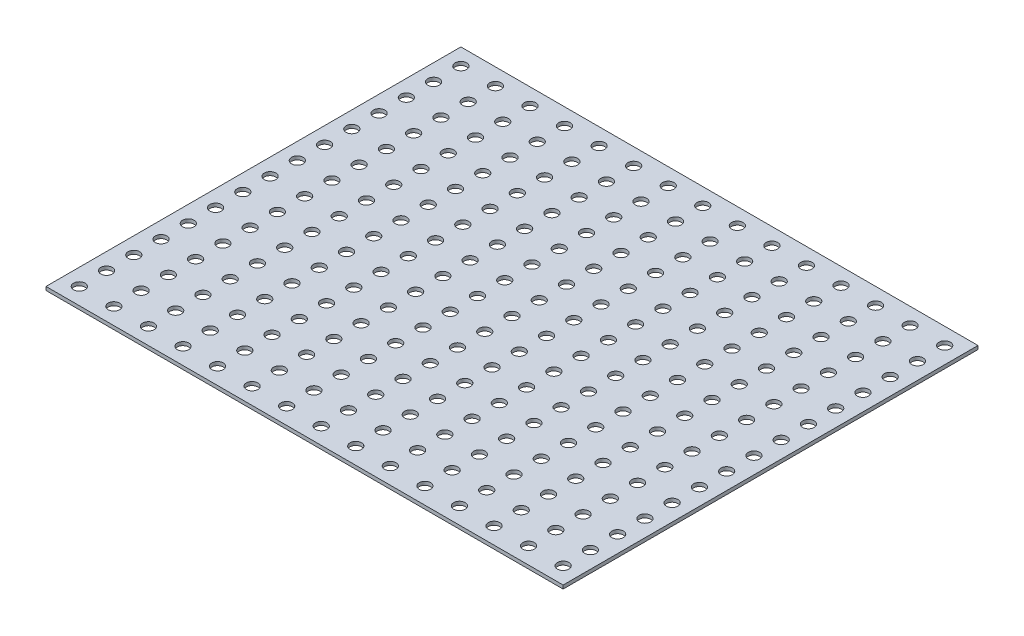
from build123d import *

# Parameters (mm, degrees)
SKETCH1_W           = 189.74
SKETCH1_H           = 152.22
SKETCH1_R           = 2.11
BOSS_EXTRUDE1_DEPTH = 1.3


with BuildPart() as part:
    # Sketch1 → Boss-Extrude1 (new body)
    with BuildSketch(Plane(origin=(0, 0, 0), x_dir=(1, 0, 0), z_dir=(0, 1, 0))):
        with Locations((70.568763426, -57.971179366)):
            Rectangle(SKETCH1_W, SKETCH1_H)
        with Locations(Location((-18.191236574, 12.028820634, 0), (0, 0, 270))):
            Circle(SKETCH1_R, mode=Mode.SUBTRACT)
        with Locations(Location((-5.511236574, 12.028820634, 0), (0, 0, 270))):
            Circle(SKETCH1_R, mode=Mode.SUBTRACT)
        with Locations(Location((7.168763426, 12.028820634, 0), (0, 0, 270))):
            Circle(SKETCH1_R, mode=Mode.SUBTRACT)
        with Locations(Location((19.848763426, 12.028820634, 0), (0, 0, 270))):
            Circle(SKETCH1_R, mode=Mode.SUBTRACT)
        with Locations(Location((32.528763426, 12.028820634, 0), (0, 0, 270))):
            Circle(SKETCH1_R, mode=Mode.SUBTRACT)
        with Locations(Location((45.208763426, 12.028820634, 0), (0, 0, 270))):
            Circle(SKETCH1_R, mode=Mode.SUBTRACT)
        with Locations(Location((57.888763426, 12.028820634, 0), (0, 0, 270))):
            Circle(SKETCH1_R, mode=Mode.SUBTRACT)
        with Locations(Location((70.568763426, 12.028820634, 0), (0, 0, 270))):
            Circle(SKETCH1_R, mode=Mode.SUBTRACT)
        with Locations(Location((83.248763426, 12.028820634, 0), (0, 0, 270))):
            Circle(SKETCH1_R, mode=Mode.SUBTRACT)
        with Locations(Location((95.928763426, 12.028820634, 0), (0, 0, 270))):
            Circle(SKETCH1_R, mode=Mode.SUBTRACT)
        with Locations(Location((108.608763426, 12.028820634, 0), (0, 0, 270))):
            Circle(SKETCH1_R, mode=Mode.SUBTRACT)
        with Locations(Location((121.288763426, 12.028820634, 0), (0, 0, 270))):
            Circle(SKETCH1_R, mode=Mode.SUBTRACT)
        with Locations(Location((133.968763426, 12.028820634, 0), (0, 0, 270))):
            Circle(SKETCH1_R, mode=Mode.SUBTRACT)
        with Locations(Location((146.648763426, 12.028820634, 0), (0, 0, 270))):
            Circle(SKETCH1_R, mode=Mode.SUBTRACT)
        with Locations(Location((159.328763426, 12.028820634, 0), (0, 0, 270))):
            Circle(SKETCH1_R, mode=Mode.SUBTRACT)
        with Locations(Location((-5.511236574, 2.028820634, 0), (0, 0, 270))):
            Circle(SKETCH1_R, mode=Mode.SUBTRACT)
        with Locations(Location((7.168763426, 2.028820634, 0), (0, 0, 270))):
            Circle(SKETCH1_R, mode=Mode.SUBTRACT)
        with Locations(Location((19.848763426, 2.028820634, 0), (0, 0, 270))):
            Circle(SKETCH1_R, mode=Mode.SUBTRACT)
        with Locations(Location((32.528763426, 2.028820634, 0), (0, 0, 270))):
            Circle(SKETCH1_R, mode=Mode.SUBTRACT)
        with Locations(Location((45.208763426, 2.028820634, 0), (0, 0, 270))):
            Circle(SKETCH1_R, mode=Mode.SUBTRACT)
        with Locations(Location((57.888763426, 2.028820634, 0), (0, 0, 270))):
            Circle(SKETCH1_R, mode=Mode.SUBTRACT)
        with Locations(Location((70.568763426, 2.028820634, 0), (0, 0, 270))):
            Circle(SKETCH1_R, mode=Mode.SUBTRACT)
        with Locations(Location((83.248763426, 2.028820634, 0), (0, 0, 270))):
            Circle(SKETCH1_R, mode=Mode.SUBTRACT)
        with Locations(Location((95.928763426, 2.028820634, 0), (0, 0, 270))):
            Circle(SKETCH1_R, mode=Mode.SUBTRACT)
        with Locations(Location((108.608763426, 2.028820634, 0), (0, 0, 270))):
            Circle(SKETCH1_R, mode=Mode.SUBTRACT)
        with Locations(Location((121.288763426, 2.028820634, 0), (0, 0, 270))):
            Circle(SKETCH1_R, mode=Mode.SUBTRACT)
        with Locations(Location((133.968763426, 2.028820634, 0), (0, 0, 270))):
            Circle(SKETCH1_R, mode=Mode.SUBTRACT)
        with Locations(Location((146.648763426, 2.028820634, 0), (0, 0, 270))):
            Circle(SKETCH1_R, mode=Mode.SUBTRACT)
        with Locations(Location((159.328763426, 2.028820634, 0), (0, 0, 270))):
            Circle(SKETCH1_R, mode=Mode.SUBTRACT)
        with Locations(Location((-5.511236574, -7.971179366, 0), (0, 0, 270))):
            Circle(SKETCH1_R, mode=Mode.SUBTRACT)
        with Locations(Location((7.168763426, -7.971179366, 0), (0, 0, 270))):
            Circle(SKETCH1_R, mode=Mode.SUBTRACT)
        with Locations(Location((19.848763426, -7.971179366, 0), (0, 0, 270))):
            Circle(SKETCH1_R, mode=Mode.SUBTRACT)
        with Locations(Location((32.528763426, -7.971179366, 0), (0, 0, 270))):
            Circle(SKETCH1_R, mode=Mode.SUBTRACT)
        with Locations(Location((45.208763426, -7.971179366, 0), (0, 0, 270))):
            Circle(SKETCH1_R, mode=Mode.SUBTRACT)
        with Locations(Location((57.888763426, -7.971179366, 0), (0, 0, 270))):
            Circle(SKETCH1_R, mode=Mode.SUBTRACT)
        with Locations(Location((70.568763426, -7.971179366, 0), (0, 0, 270))):
            Circle(SKETCH1_R, mode=Mode.SUBTRACT)
        with Locations(Location((83.248763426, -7.971179366, 0), (0, 0, 270))):
            Circle(SKETCH1_R, mode=Mode.SUBTRACT)
        with Locations(Location((95.928763426, -7.971179366, 0), (0, 0, 270))):
            Circle(SKETCH1_R, mode=Mode.SUBTRACT)
        with Locations(Location((108.608763426, -7.971179366, 0), (0, 0, 270))):
            Circle(SKETCH1_R, mode=Mode.SUBTRACT)
        with Locations(Location((121.288763426, -7.971179366, 0), (0, 0, 270))):
            Circle(SKETCH1_R, mode=Mode.SUBTRACT)
        with Locations(Location((133.968763426, -7.971179366, 0), (0, 0, 270))):
            Circle(SKETCH1_R, mode=Mode.SUBTRACT)
        with Locations(Location((146.648763426, -7.971179366, 0), (0, 0, 270))):
            Circle(SKETCH1_R, mode=Mode.SUBTRACT)
        with Locations(Location((159.328763426, -7.971179366, 0), (0, 0, 270))):
            Circle(SKETCH1_R, mode=Mode.SUBTRACT)
        with Locations(Location((-5.511236574, -17.971179366, 0), (0, 0, 270))):
            Circle(SKETCH1_R, mode=Mode.SUBTRACT)
        with Locations(Location((7.168763426, -17.971179366, 0), (0, 0, 270))):
            Circle(SKETCH1_R, mode=Mode.SUBTRACT)
        with Locations(Location((19.848763426, -17.971179366, 0), (0, 0, 270))):
            Circle(SKETCH1_R, mode=Mode.SUBTRACT)
        with Locations(Location((32.528763426, -17.971179366, 0), (0, 0, 270))):
            Circle(SKETCH1_R, mode=Mode.SUBTRACT)
        with Locations(Location((45.208763426, -17.971179366, 0), (0, 0, 270))):
            Circle(SKETCH1_R, mode=Mode.SUBTRACT)
        with Locations(Location((57.888763426, -17.971179366, 0), (0, 0, 270))):
            Circle(SKETCH1_R, mode=Mode.SUBTRACT)
        with Locations(Location((70.568763426, -17.971179366, 0), (0, 0, 270))):
            Circle(SKETCH1_R, mode=Mode.SUBTRACT)
        with Locations(Location((83.248763426, -17.971179366, 0), (0, 0, 270))):
            Circle(SKETCH1_R, mode=Mode.SUBTRACT)
        with Locations(Location((95.928763426, -17.971179366, 0), (0, 0, 270))):
            Circle(SKETCH1_R, mode=Mode.SUBTRACT)
        with Locations(Location((108.608763426, -17.971179366, 0), (0, 0, 270))):
            Circle(SKETCH1_R, mode=Mode.SUBTRACT)
        with Locations(Location((121.288763426, -17.971179366, 0), (0, 0, 270))):
            Circle(SKETCH1_R, mode=Mode.SUBTRACT)
        with Locations(Location((133.968763426, -17.971179366, 0), (0, 0, 270))):
            Circle(SKETCH1_R, mode=Mode.SUBTRACT)
        with Locations(Location((146.648763426, -17.971179366, 0), (0, 0, 270))):
            Circle(SKETCH1_R, mode=Mode.SUBTRACT)
        with Locations(Location((159.328763426, -17.971179366, 0), (0, 0, 270))):
            Circle(SKETCH1_R, mode=Mode.SUBTRACT)
        with Locations(Location((-5.511236574, -27.971179366, 0), (0, 0, 270))):
            Circle(SKETCH1_R, mode=Mode.SUBTRACT)
        with Locations(Location((7.168763426, -27.971179366, 0), (0, 0, 270))):
            Circle(SKETCH1_R, mode=Mode.SUBTRACT)
        with Locations(Location((19.848763426, -27.971179366, 0), (0, 0, 270))):
            Circle(SKETCH1_R, mode=Mode.SUBTRACT)
        with Locations(Location((32.528763426, -27.971179366, 0), (0, 0, 270))):
            Circle(SKETCH1_R, mode=Mode.SUBTRACT)
        with Locations(Location((45.208763426, -27.971179366, 0), (0, 0, 270))):
            Circle(SKETCH1_R, mode=Mode.SUBTRACT)
        with Locations(Location((57.888763426, -27.971179366, 0), (0, 0, 270))):
            Circle(SKETCH1_R, mode=Mode.SUBTRACT)
        with Locations(Location((70.568763426, -27.971179366, 0), (0, 0, 270))):
            Circle(SKETCH1_R, mode=Mode.SUBTRACT)
        with Locations(Location((83.248763426, -27.971179366, 0), (0, 0, 270))):
            Circle(SKETCH1_R, mode=Mode.SUBTRACT)
        with Locations(Location((95.928763426, -27.971179366, 0), (0, 0, 270))):
            Circle(SKETCH1_R, mode=Mode.SUBTRACT)
        with Locations(Location((108.608763426, -27.971179366, 0), (0, 0, 270))):
            Circle(SKETCH1_R, mode=Mode.SUBTRACT)
        with Locations(Location((121.288763426, -27.971179366, 0), (0, 0, 270))):
            Circle(SKETCH1_R, mode=Mode.SUBTRACT)
        with Locations(Location((133.968763426, -27.971179366, 0), (0, 0, 270))):
            Circle(SKETCH1_R, mode=Mode.SUBTRACT)
        with Locations(Location((146.648763426, -27.971179366, 0), (0, 0, 270))):
            Circle(SKETCH1_R, mode=Mode.SUBTRACT)
        with Locations(Location((159.328763426, -27.971179366, 0), (0, 0, 270))):
            Circle(SKETCH1_R, mode=Mode.SUBTRACT)
        with Locations(Location((-5.511236574, -37.971179366, 0), (0, 0, 270))):
            Circle(SKETCH1_R, mode=Mode.SUBTRACT)
        with Locations(Location((7.168763426, -37.971179366, 0), (0, 0, 270))):
            Circle(SKETCH1_R, mode=Mode.SUBTRACT)
        with Locations(Location((19.848763426, -37.971179366, 0), (0, 0, 270))):
            Circle(SKETCH1_R, mode=Mode.SUBTRACT)
        with Locations(Location((32.528763426, -37.971179366, 0), (0, 0, 270))):
            Circle(SKETCH1_R, mode=Mode.SUBTRACT)
        with Locations(Location((45.208763426, -37.971179366, 0), (0, 0, 270))):
            Circle(SKETCH1_R, mode=Mode.SUBTRACT)
        with Locations(Location((57.888763426, -37.971179366, 0), (0, 0, 270))):
            Circle(SKETCH1_R, mode=Mode.SUBTRACT)
        with Locations(Location((70.568763426, -37.971179366, 0), (0, 0, 270))):
            Circle(SKETCH1_R, mode=Mode.SUBTRACT)
        with Locations(Location((83.248763426, -37.971179366, 0), (0, 0, 270))):
            Circle(SKETCH1_R, mode=Mode.SUBTRACT)
        with Locations(Location((95.928763426, -37.971179366, 0), (0, 0, 270))):
            Circle(SKETCH1_R, mode=Mode.SUBTRACT)
        with Locations(Location((108.608763426, -37.971179366, 0), (0, 0, 270))):
            Circle(SKETCH1_R, mode=Mode.SUBTRACT)
        with Locations(Location((121.288763426, -37.971179366, 0), (0, 0, 270))):
            Circle(SKETCH1_R, mode=Mode.SUBTRACT)
        with Locations(Location((133.968763426, -37.971179366, 0), (0, 0, 270))):
            Circle(SKETCH1_R, mode=Mode.SUBTRACT)
        with Locations(Location((146.648763426, -37.971179366, 0), (0, 0, 270))):
            Circle(SKETCH1_R, mode=Mode.SUBTRACT)
        with Locations(Location((159.328763426, -37.971179366, 0), (0, 0, 270))):
            Circle(SKETCH1_R, mode=Mode.SUBTRACT)
        with Locations(Location((-5.511236574, -47.971179366, 0), (0, 0, 270))):
            Circle(SKETCH1_R, mode=Mode.SUBTRACT)
        with Locations(Location((7.168763426, -47.971179366, 0), (0, 0, 270))):
            Circle(SKETCH1_R, mode=Mode.SUBTRACT)
        with Locations(Location((19.848763426, -47.971179366, 0), (0, 0, 270))):
            Circle(SKETCH1_R, mode=Mode.SUBTRACT)
        with Locations(Location((32.528763426, -47.971179366, 0), (0, 0, 270))):
            Circle(SKETCH1_R, mode=Mode.SUBTRACT)
        with Locations(Location((45.208763426, -47.971179366, 0), (0, 0, 270))):
            Circle(SKETCH1_R, mode=Mode.SUBTRACT)
        with Locations(Location((57.888763426, -47.971179366, 0), (0, 0, 270))):
            Circle(SKETCH1_R, mode=Mode.SUBTRACT)
        with Locations(Location((70.568763426, -47.971179366, 0), (0, 0, 270))):
            Circle(SKETCH1_R, mode=Mode.SUBTRACT)
        with Locations(Location((83.248763426, -47.971179366, 0), (0, 0, 270))):
            Circle(SKETCH1_R, mode=Mode.SUBTRACT)
        with Locations(Location((95.928763426, -47.971179366, 0), (0, 0, 270))):
            Circle(SKETCH1_R, mode=Mode.SUBTRACT)
        with Locations(Location((108.608763426, -47.971179366, 0), (0, 0, 270))):
            Circle(SKETCH1_R, mode=Mode.SUBTRACT)
        with Locations(Location((121.288763426, -47.971179366, 0), (0, 0, 270))):
            Circle(SKETCH1_R, mode=Mode.SUBTRACT)
        with Locations(Location((133.968763426, -47.971179366, 0), (0, 0, 270))):
            Circle(SKETCH1_R, mode=Mode.SUBTRACT)
        with Locations(Location((146.648763426, -47.971179366, 0), (0, 0, 270))):
            Circle(SKETCH1_R, mode=Mode.SUBTRACT)
        with Locations(Location((159.328763426, -47.971179366, 0), (0, 0, 270))):
            Circle(SKETCH1_R, mode=Mode.SUBTRACT)
        with Locations(Location((-5.511236574, -57.971179366, 0), (0, 0, 270))):
            Circle(SKETCH1_R, mode=Mode.SUBTRACT)
        with Locations(Location((7.168763426, -57.971179366, 0), (0, 0, 270))):
            Circle(SKETCH1_R, mode=Mode.SUBTRACT)
        with Locations(Location((19.848763426, -57.971179366, 0), (0, 0, 270))):
            Circle(SKETCH1_R, mode=Mode.SUBTRACT)
        with Locations(Location((32.528763426, -57.971179366, 0), (0, 0, 270))):
            Circle(SKETCH1_R, mode=Mode.SUBTRACT)
        with Locations(Location((45.208763426, -57.971179366, 0), (0, 0, 270))):
            Circle(SKETCH1_R, mode=Mode.SUBTRACT)
        with Locations(Location((57.888763426, -57.971179366, 0), (0, 0, 270))):
            Circle(SKETCH1_R, mode=Mode.SUBTRACT)
        with Locations(Location((70.568763426, -57.971179366, 0), (0, 0, 270))):
            Circle(SKETCH1_R, mode=Mode.SUBTRACT)
        with Locations(Location((83.248763426, -57.971179366, 0), (0, 0, 270))):
            Circle(SKETCH1_R, mode=Mode.SUBTRACT)
        with Locations(Location((95.928763426, -57.971179366, 0), (0, 0, 270))):
            Circle(SKETCH1_R, mode=Mode.SUBTRACT)
        with Locations(Location((108.608763426, -57.971179366, 0), (0, 0, 270))):
            Circle(SKETCH1_R, mode=Mode.SUBTRACT)
        with Locations(Location((121.288763426, -57.971179366, 0), (0, 0, 270))):
            Circle(SKETCH1_R, mode=Mode.SUBTRACT)
        with Locations(Location((133.968763426, -57.971179366, 0), (0, 0, 270))):
            Circle(SKETCH1_R, mode=Mode.SUBTRACT)
        with Locations(Location((146.648763426, -57.971179366, 0), (0, 0, 270))):
            Circle(SKETCH1_R, mode=Mode.SUBTRACT)
        with Locations(Location((159.328763426, -57.971179366, 0), (0, 0, 270))):
            Circle(SKETCH1_R, mode=Mode.SUBTRACT)
        with Locations(Location((-5.511236574, -67.971179366, 0), (0, 0, 270))):
            Circle(SKETCH1_R, mode=Mode.SUBTRACT)
        with Locations(Location((7.168763426, -67.971179366, 0), (0, 0, 270))):
            Circle(SKETCH1_R, mode=Mode.SUBTRACT)
        with Locations(Location((19.848763426, -67.971179366, 0), (0, 0, 270))):
            Circle(SKETCH1_R, mode=Mode.SUBTRACT)
        with Locations(Location((32.528763426, -67.971179366, 0), (0, 0, 270))):
            Circle(SKETCH1_R, mode=Mode.SUBTRACT)
        with Locations(Location((45.208763426, -67.971179366, 0), (0, 0, 270))):
            Circle(SKETCH1_R, mode=Mode.SUBTRACT)
        with Locations(Location((57.888763426, -67.971179366, 0), (0, 0, 270))):
            Circle(SKETCH1_R, mode=Mode.SUBTRACT)
        with Locations(Location((70.568763426, -67.971179366, 0), (0, 0, 270))):
            Circle(SKETCH1_R, mode=Mode.SUBTRACT)
        with Locations(Location((83.248763426, -67.971179366, 0), (0, 0, 270))):
            Circle(SKETCH1_R, mode=Mode.SUBTRACT)
        with Locations(Location((95.928763426, -67.971179366, 0), (0, 0, 270))):
            Circle(SKETCH1_R, mode=Mode.SUBTRACT)
        with Locations(Location((108.608763426, -67.971179366, 0), (0, 0, 270))):
            Circle(SKETCH1_R, mode=Mode.SUBTRACT)
        with Locations(Location((121.288763426, -67.971179366, 0), (0, 0, 270))):
            Circle(SKETCH1_R, mode=Mode.SUBTRACT)
        with Locations(Location((133.968763426, -67.971179366, 0), (0, 0, 270))):
            Circle(SKETCH1_R, mode=Mode.SUBTRACT)
        with Locations(Location((146.648763426, -67.971179366, 0), (0, 0, 270))):
            Circle(SKETCH1_R, mode=Mode.SUBTRACT)
        with Locations(Location((159.328763426, -67.971179366, 0), (0, 0, 270))):
            Circle(SKETCH1_R, mode=Mode.SUBTRACT)
        with Locations(Location((-5.511236574, -77.971179366, 0), (0, 0, 270))):
            Circle(SKETCH1_R, mode=Mode.SUBTRACT)
        with Locations(Location((7.168763426, -77.971179366, 0), (0, 0, 270))):
            Circle(SKETCH1_R, mode=Mode.SUBTRACT)
        with Locations(Location((19.848763426, -77.971179366, 0), (0, 0, 270))):
            Circle(SKETCH1_R, mode=Mode.SUBTRACT)
        with Locations(Location((32.528763426, -77.971179366, 0), (0, 0, 270))):
            Circle(SKETCH1_R, mode=Mode.SUBTRACT)
        with Locations(Location((45.208763426, -77.971179366, 0), (0, 0, 270))):
            Circle(SKETCH1_R, mode=Mode.SUBTRACT)
        with Locations(Location((57.888763426, -77.971179366, 0), (0, 0, 270))):
            Circle(SKETCH1_R, mode=Mode.SUBTRACT)
        with Locations(Location((70.568763426, -77.971179366, 0), (0, 0, 270))):
            Circle(SKETCH1_R, mode=Mode.SUBTRACT)
        with Locations(Location((83.248763426, -77.971179366, 0), (0, 0, 270))):
            Circle(SKETCH1_R, mode=Mode.SUBTRACT)
        with Locations(Location((95.928763426, -77.971179366, 0), (0, 0, 270))):
            Circle(SKETCH1_R, mode=Mode.SUBTRACT)
        with Locations(Location((108.608763426, -77.971179366, 0), (0, 0, 270))):
            Circle(SKETCH1_R, mode=Mode.SUBTRACT)
        with Locations(Location((121.288763426, -77.971179366, 0), (0, 0, 270))):
            Circle(SKETCH1_R, mode=Mode.SUBTRACT)
        with Locations(Location((133.968763426, -77.971179366, 0), (0, 0, 270))):
            Circle(SKETCH1_R, mode=Mode.SUBTRACT)
        with Locations(Location((146.648763426, -77.971179366, 0), (0, 0, 270))):
            Circle(SKETCH1_R, mode=Mode.SUBTRACT)
        with Locations(Location((159.328763426, -77.971179366, 0), (0, 0, 270))):
            Circle(SKETCH1_R, mode=Mode.SUBTRACT)
        with Locations(Location((-5.511236574, -87.971179366, 0), (0, 0, 270))):
            Circle(SKETCH1_R, mode=Mode.SUBTRACT)
        with Locations(Location((7.168763426, -87.971179366, 0), (0, 0, 270))):
            Circle(SKETCH1_R, mode=Mode.SUBTRACT)
        with Locations(Location((19.848763426, -87.971179366, 0), (0, 0, 270))):
            Circle(SKETCH1_R, mode=Mode.SUBTRACT)
        with Locations(Location((32.528763426, -87.971179366, 0), (0, 0, 270))):
            Circle(SKETCH1_R, mode=Mode.SUBTRACT)
        with Locations(Location((45.208763426, -87.971179366, 0), (0, 0, 270))):
            Circle(SKETCH1_R, mode=Mode.SUBTRACT)
        with Locations(Location((57.888763426, -87.971179366, 0), (0, 0, 270))):
            Circle(SKETCH1_R, mode=Mode.SUBTRACT)
        with Locations(Location((70.568763426, -87.971179366, 0), (0, 0, 270))):
            Circle(SKETCH1_R, mode=Mode.SUBTRACT)
        with Locations(Location((83.248763426, -87.971179366, 0), (0, 0, 270))):
            Circle(SKETCH1_R, mode=Mode.SUBTRACT)
        with Locations(Location((95.928763426, -87.971179366, 0), (0, 0, 270))):
            Circle(SKETCH1_R, mode=Mode.SUBTRACT)
        with Locations(Location((108.608763426, -87.971179366, 0), (0, 0, 270))):
            Circle(SKETCH1_R, mode=Mode.SUBTRACT)
        with Locations(Location((121.288763426, -87.971179366, 0), (0, 0, 270))):
            Circle(SKETCH1_R, mode=Mode.SUBTRACT)
        with Locations(Location((133.968763426, -87.971179366, 0), (0, 0, 270))):
            Circle(SKETCH1_R, mode=Mode.SUBTRACT)
        with Locations(Location((146.648763426, -87.971179366, 0), (0, 0, 270))):
            Circle(SKETCH1_R, mode=Mode.SUBTRACT)
        with Locations(Location((159.328763426, -87.971179366, 0), (0, 0, 270))):
            Circle(SKETCH1_R, mode=Mode.SUBTRACT)
        with Locations(Location((-5.511236574, -97.971179366, 0), (0, 0, 270))):
            Circle(SKETCH1_R, mode=Mode.SUBTRACT)
        with Locations(Location((7.168763426, -97.971179366, 0), (0, 0, 270))):
            Circle(SKETCH1_R, mode=Mode.SUBTRACT)
        with Locations(Location((19.848763426, -97.971179366, 0), (0, 0, 270))):
            Circle(SKETCH1_R, mode=Mode.SUBTRACT)
        with Locations(Location((32.528763426, -97.971179366, 0), (0, 0, 270))):
            Circle(SKETCH1_R, mode=Mode.SUBTRACT)
        with Locations(Location((45.208763426, -97.971179366, 0), (0, 0, 270))):
            Circle(SKETCH1_R, mode=Mode.SUBTRACT)
        with Locations(Location((57.888763426, -97.971179366, 0), (0, 0, 270))):
            Circle(SKETCH1_R, mode=Mode.SUBTRACT)
        with Locations(Location((70.568763426, -97.971179366, 0), (0, 0, 270))):
            Circle(SKETCH1_R, mode=Mode.SUBTRACT)
        with Locations(Location((83.248763426, -97.971179366, 0), (0, 0, 270))):
            Circle(SKETCH1_R, mode=Mode.SUBTRACT)
        with Locations(Location((95.928763426, -97.971179366, 0), (0, 0, 270))):
            Circle(SKETCH1_R, mode=Mode.SUBTRACT)
        with Locations(Location((108.608763426, -97.971179366, 0), (0, 0, 270))):
            Circle(SKETCH1_R, mode=Mode.SUBTRACT)
        with Locations(Location((121.288763426, -97.971179366, 0), (0, 0, 270))):
            Circle(SKETCH1_R, mode=Mode.SUBTRACT)
        with Locations(Location((133.968763426, -97.971179366, 0), (0, 0, 270))):
            Circle(SKETCH1_R, mode=Mode.SUBTRACT)
        with Locations(Location((146.648763426, -97.971179366, 0), (0, 0, 270))):
            Circle(SKETCH1_R, mode=Mode.SUBTRACT)
        with Locations(Location((159.328763426, -97.971179366, 0), (0, 0, 270))):
            Circle(SKETCH1_R, mode=Mode.SUBTRACT)
        with Locations(Location((-5.511236574, -107.971179366, 0), (0, 0, 270))):
            Circle(SKETCH1_R, mode=Mode.SUBTRACT)
        with Locations(Location((7.168763426, -107.971179366, 0), (0, 0, 270))):
            Circle(SKETCH1_R, mode=Mode.SUBTRACT)
        with Locations(Location((19.848763426, -107.971179366, 0), (0, 0, 270))):
            Circle(SKETCH1_R, mode=Mode.SUBTRACT)
        with Locations(Location((32.528763426, -107.971179366, 0), (0, 0, 270))):
            Circle(SKETCH1_R, mode=Mode.SUBTRACT)
        with Locations(Location((45.208763426, -107.971179366, 0), (0, 0, 270))):
            Circle(SKETCH1_R, mode=Mode.SUBTRACT)
        with Locations(Location((57.888763426, -107.971179366, 0), (0, 0, 270))):
            Circle(SKETCH1_R, mode=Mode.SUBTRACT)
        with Locations(Location((70.568763426, -107.971179366, 0), (0, 0, 270))):
            Circle(SKETCH1_R, mode=Mode.SUBTRACT)
        with Locations(Location((83.248763426, -107.971179366, 0), (0, 0, 270))):
            Circle(SKETCH1_R, mode=Mode.SUBTRACT)
        with Locations(Location((95.928763426, -107.971179366, 0), (0, 0, 270))):
            Circle(SKETCH1_R, mode=Mode.SUBTRACT)
        with Locations(Location((108.608763426, -107.971179366, 0), (0, 0, 270))):
            Circle(SKETCH1_R, mode=Mode.SUBTRACT)
        with Locations(Location((121.288763426, -107.971179366, 0), (0, 0, 270))):
            Circle(SKETCH1_R, mode=Mode.SUBTRACT)
        with Locations(Location((133.968763426, -107.971179366, 0), (0, 0, 270))):
            Circle(SKETCH1_R, mode=Mode.SUBTRACT)
        with Locations(Location((146.648763426, -107.971179366, 0), (0, 0, 270))):
            Circle(SKETCH1_R, mode=Mode.SUBTRACT)
        with Locations(Location((159.328763426, -107.971179366, 0), (0, 0, 270))):
            Circle(SKETCH1_R, mode=Mode.SUBTRACT)
        with Locations(Location((-5.511236574, -117.971179366, 0), (0, 0, 270))):
            Circle(SKETCH1_R, mode=Mode.SUBTRACT)
        with Locations(Location((7.168763426, -117.971179366, 0), (0, 0, 270))):
            Circle(SKETCH1_R, mode=Mode.SUBTRACT)
        with Locations(Location((19.848763426, -117.971179366, 0), (0, 0, 270))):
            Circle(SKETCH1_R, mode=Mode.SUBTRACT)
        with Locations(Location((32.528763426, -117.971179366, 0), (0, 0, 270))):
            Circle(SKETCH1_R, mode=Mode.SUBTRACT)
        with Locations(Location((45.208763426, -117.971179366, 0), (0, 0, 270))):
            Circle(SKETCH1_R, mode=Mode.SUBTRACT)
        with Locations(Location((57.888763426, -117.971179366, 0), (0, 0, 270))):
            Circle(SKETCH1_R, mode=Mode.SUBTRACT)
        with Locations(Location((70.568763426, -117.971179366, 0), (0, 0, 270))):
            Circle(SKETCH1_R, mode=Mode.SUBTRACT)
        with Locations(Location((83.248763426, -117.971179366, 0), (0, 0, 270))):
            Circle(SKETCH1_R, mode=Mode.SUBTRACT)
        with Locations(Location((95.928763426, -117.971179366, 0), (0, 0, 270))):
            Circle(SKETCH1_R, mode=Mode.SUBTRACT)
        with Locations(Location((108.608763426, -117.971179366, 0), (0, 0, 270))):
            Circle(SKETCH1_R, mode=Mode.SUBTRACT)
        with Locations(Location((121.288763426, -117.971179366, 0), (0, 0, 270))):
            Circle(SKETCH1_R, mode=Mode.SUBTRACT)
        with Locations(Location((133.968763426, -117.971179366, 0), (0, 0, 270))):
            Circle(SKETCH1_R, mode=Mode.SUBTRACT)
        with Locations(Location((146.648763426, -117.971179366, 0), (0, 0, 270))):
            Circle(SKETCH1_R, mode=Mode.SUBTRACT)
        with Locations(Location((159.328763426, -117.971179366, 0), (0, 0, 270))):
            Circle(SKETCH1_R, mode=Mode.SUBTRACT)
        with Locations(Location((-5.511236574, -127.971179366, 0), (0, 0, 270))):
            Circle(SKETCH1_R, mode=Mode.SUBTRACT)
        with Locations(Location((7.168763426, -127.971179366, 0), (0, 0, 270))):
            Circle(SKETCH1_R, mode=Mode.SUBTRACT)
        with Locations(Location((19.848763426, -127.971179366, 0), (0, 0, 270))):
            Circle(SKETCH1_R, mode=Mode.SUBTRACT)
        with Locations(Location((32.528763426, -127.971179366, 0), (0, 0, 270))):
            Circle(SKETCH1_R, mode=Mode.SUBTRACT)
        with Locations(Location((45.208763426, -127.971179366, 0), (0, 0, 270))):
            Circle(SKETCH1_R, mode=Mode.SUBTRACT)
        with Locations(Location((57.888763426, -127.971179366, 0), (0, 0, 270))):
            Circle(SKETCH1_R, mode=Mode.SUBTRACT)
        with Locations(Location((70.568763426, -127.971179366, 0), (0, 0, 270))):
            Circle(SKETCH1_R, mode=Mode.SUBTRACT)
        with Locations(Location((83.248763426, -127.971179366, 0), (0, 0, 270))):
            Circle(SKETCH1_R, mode=Mode.SUBTRACT)
        with Locations(Location((95.928763426, -127.971179366, 0), (0, 0, 270))):
            Circle(SKETCH1_R, mode=Mode.SUBTRACT)
        with Locations(Location((108.608763426, -127.971179366, 0), (0, 0, 270))):
            Circle(SKETCH1_R, mode=Mode.SUBTRACT)
        with Locations(Location((121.288763426, -127.971179366, 0), (0, 0, 270))):
            Circle(SKETCH1_R, mode=Mode.SUBTRACT)
        with Locations(Location((133.968763426, -127.971179366, 0), (0, 0, 270))):
            Circle(SKETCH1_R, mode=Mode.SUBTRACT)
        with Locations(Location((146.648763426, -127.971179366, 0), (0, 0, 270))):
            Circle(SKETCH1_R, mode=Mode.SUBTRACT)
        with Locations(Location((159.328763426, -127.971179366, 0), (0, 0, 270))):
            Circle(SKETCH1_R, mode=Mode.SUBTRACT)
        with Locations(Location((-18.191236574, 2.028820634, 0), (0, 0, 270))):
            Circle(SKETCH1_R, mode=Mode.SUBTRACT)
        with Locations(Location((-18.191236574, -7.971179366, 0), (0, 0, 270))):
            Circle(SKETCH1_R, mode=Mode.SUBTRACT)
        with Locations(Location((-18.191236574, -17.971179366, 0), (0, 0, 270))):
            Circle(SKETCH1_R, mode=Mode.SUBTRACT)
        with Locations(Location((-18.191236574, -27.971179366, 0), (0, 0, 270))):
            Circle(SKETCH1_R, mode=Mode.SUBTRACT)
        with Locations(Location((-18.191236574, -37.971179366, 0), (0, 0, 270))):
            Circle(SKETCH1_R, mode=Mode.SUBTRACT)
        with Locations(Location((-18.191236574, -47.971179366, 0), (0, 0, 270))):
            Circle(SKETCH1_R, mode=Mode.SUBTRACT)
        with Locations(Location((-18.191236574, -57.971179366, 0), (0, 0, 270))):
            Circle(SKETCH1_R, mode=Mode.SUBTRACT)
        with Locations(Location((-18.191236574, -67.971179366, 0), (0, 0, 270))):
            Circle(SKETCH1_R, mode=Mode.SUBTRACT)
        with Locations(Location((-18.191236574, -77.971179366, 0), (0, 0, 270))):
            Circle(SKETCH1_R, mode=Mode.SUBTRACT)
        with Locations(Location((-18.191236574, -87.971179366, 0), (0, 0, 270))):
            Circle(SKETCH1_R, mode=Mode.SUBTRACT)
        with Locations(Location((-18.191236574, -97.971179366, 0), (0, 0, 270))):
            Circle(SKETCH1_R, mode=Mode.SUBTRACT)
        with Locations(Location((-18.191236574, -107.971179366, 0), (0, 0, 270))):
            Circle(SKETCH1_R, mode=Mode.SUBTRACT)
        with Locations(Location((-18.191236574, -117.971179366, 0), (0, 0, 270))):
            Circle(SKETCH1_R, mode=Mode.SUBTRACT)
        with Locations(Location((-18.191236574, -127.971179366, 0), (0, 0, 270))):
            Circle(SKETCH1_R, mode=Mode.SUBTRACT)
    extrude(amount=-BOSS_EXTRUDE1_DEPTH)


solid = part.part
